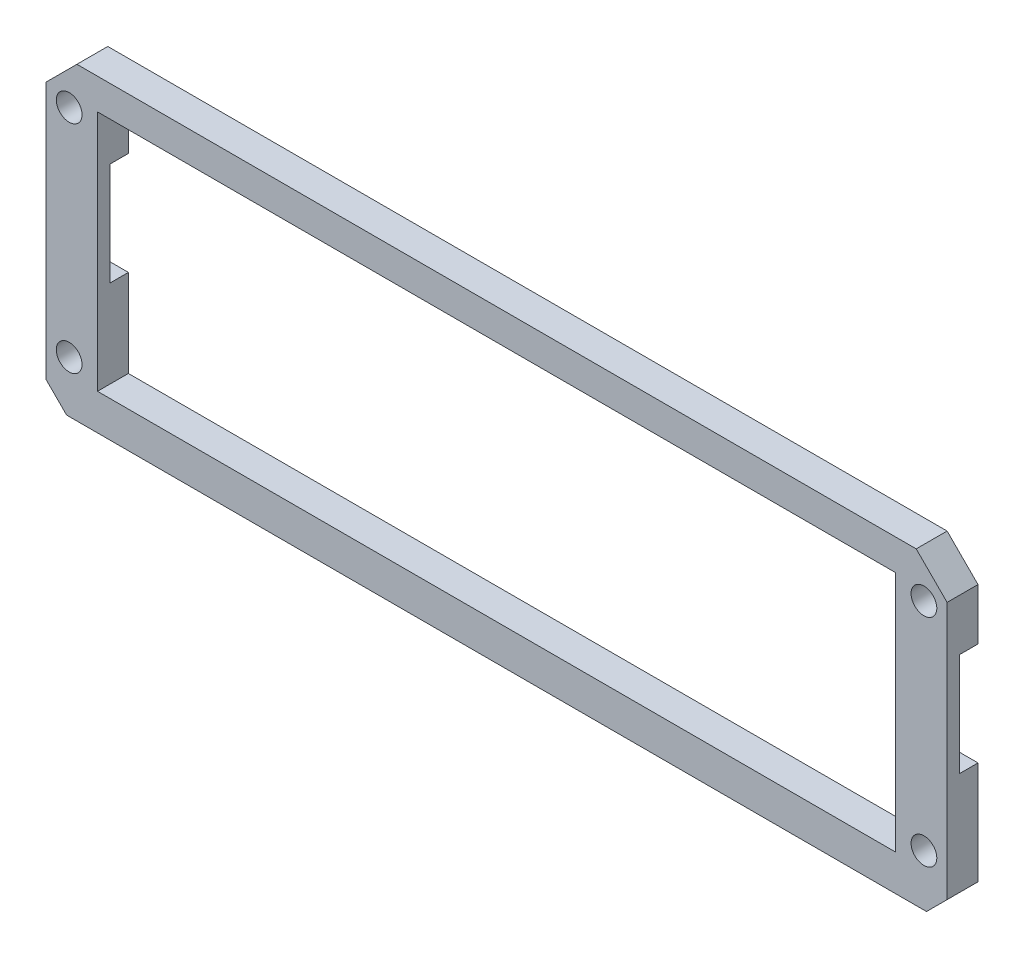
from build123d import *

# Parameters (mm, degrees)
SKETCH_1_W          = 87.5
SKETCH_1_H          = 28
EXTRUDE_1_DEPTH     = 3
SKETCH_2_R          = 1.25
SKETCH_2_W          = 77.5
SKETCH_2_H          = 22.5
CUT_EXTRUDE_1_DEPTH = 44
CHAMFER_1_SIZE      = 1
SKETCH_4_W          = 1.8
SKETCH_4_H          = 10
CUT_EXTRUDE_2_DEPTH = 92
SKETCH_5_W          = 3
SKETCH_5_H          = 3
EXTRUDE_2_DEPTH     = 87.5
EXTRUDE_3_DEPTH     = 3
SKETCH_8_W          = 77.5
SKETCH_8_H          = 3
CUT_EXTRUDE_3_DEPTH = 4
CHAMFER_3_SIZE      = 2
SKETCH_9_W          = 77.5
SKETCH_9_H          = 3
EXTRUDE_4_DEPTH     = 3
SKETCH_10_W         = 87.5
SKETCH_10_H         = 3
CUT_EXTRUDE_4_DEPTH = 3
CHAMFER_4_SIZE      = 3


with BuildPart() as part:
    # 草图1 → 凸台-拉伸1 (new body)
    with BuildSketch(Plane.XY):
        with Locations((0.266227181, -2.000151732)):
            Rectangle(SKETCH_1_W, SKETCH_1_H)
    extrude(amount=EXTRUDE_1_DEPTH)

    # 草图2 → 切除-拉伸1 (cut)
    with BuildSketch(Plane.XY.offset(3)):
        with Locations((-41.233772819, 7.999848268)):
            Circle(SKETCH_2_R)
        with Locations((-41.233772819, -13.000151732)):
            Circle(SKETCH_2_R)
        with Locations((41.766227181, -13.000151732)):
            Circle(SKETCH_2_R)
        with Locations((41.766227181, 7.999848268)):
            Circle(SKETCH_2_R)
        with Locations((0.266227181, 0.749848268)):
            Rectangle(SKETCH_2_W, SKETCH_2_H)
    extrude(amount=-CUT_EXTRUDE_1_DEPTH, mode=Mode.SUBTRACT)

    # 倒角1
    chamfer_1_edges = [part.edges().sort_by_distance(p)[0] for p in [
        (44.016227181, -16.000151732, 1.5),
        (-43.483772819, -16.000151732, 1.5),
    ]]
    chamfer(chamfer_1_edges, length=CHAMFER_1_SIZE)

    # 草图4 → 切除-拉伸2 (cut)
    with BuildSketch(Plane(origin=(44.016227181, 0, 0), x_dir=(0, 0, -1), z_dir=(1, 0, 0))):
        with Locations((-0.9, -1.000151732)):
            Rectangle(SKETCH_4_W, SKETCH_4_H)
    extrude(amount=-CUT_EXTRUDE_2_DEPTH, mode=Mode.SUBTRACT)

    # 草图5 → 凸台-拉伸2 (add)
    with BuildSketch(Plane(origin=(44.016227181, 0, 0), x_dir=(0, 0, -1), z_dir=(1, 0, 0))):
        with Locations((-1.5, 13.499848268)):
            Rectangle(SKETCH_5_W, SKETCH_5_H)
    extrude(amount=-EXTRUDE_2_DEPTH)

    # 草图7 → 凸台-拉伸3 (add)
    with BuildSketch(Plane(origin=(0, 0, 0), x_dir=(-1, 0, 0), z_dir=(0, 0, -1))):
        Polygon((-44.016227181, -15.000151732), (-44.016227181, -18.000151732), (43.483772819, -18.000151732), (43.483772819, -15.000151732), (42.983772819, -15.500151732), (-43.016227181, -16.000151732), align=None)
    extrude(amount=-EXTRUDE_3_DEPTH)

    # 草图8 → 切除-拉伸3 (cut)
    with BuildSketch(Plane(origin=(0, -10.500151732, 0), x_dir=(1, 0, 0), z_dir=(0, 1, 0))):
        with Locations((0.266227181, -1.5)):
            Rectangle(SKETCH_8_W, SKETCH_8_H)
    extrude(amount=-CUT_EXTRUDE_3_DEPTH, mode=Mode.SUBTRACT)

    # 倒角3
    chamfer_3_edges = [part.edges().sort_by_distance(p)[0] for p in [
        (44.016227181, -18.000151732, 1.5),
        (-43.483772819, -18.000151732, 1.5),
    ]]
    chamfer(chamfer_3_edges, length=CHAMFER_3_SIZE)

    # 草图9 → 凸台-拉伸4 (add)
    with BuildSketch(Plane.XZ.offset(-11.999848268)):
        with Locations((0.266227181, 1.5)):
            Rectangle(SKETCH_9_W, SKETCH_9_H)
    extrude(amount=EXTRUDE_4_DEPTH)

    # 草图10 → 切除-拉伸4 (cut)
    with BuildSketch(Plane(origin=(0, 14.999848268, 0), x_dir=(1, 0, 0), z_dir=(0, 1, 0))):
        with Locations((0.266227181, -1.5)):
            Rectangle(SKETCH_10_W, SKETCH_10_H)
    extrude(amount=-CUT_EXTRUDE_4_DEPTH, mode=Mode.SUBTRACT)

    # 倒角4
    chamfer_4_edges = [part.edges().sort_by_distance(p)[0] for p in [
        (-43.483772819, 11.999848268, 1.5),
        (44.016227181, 11.999848268, 1.5),
    ]]
    chamfer(chamfer_4_edges, length=CHAMFER_4_SIZE)


solid = part.part
